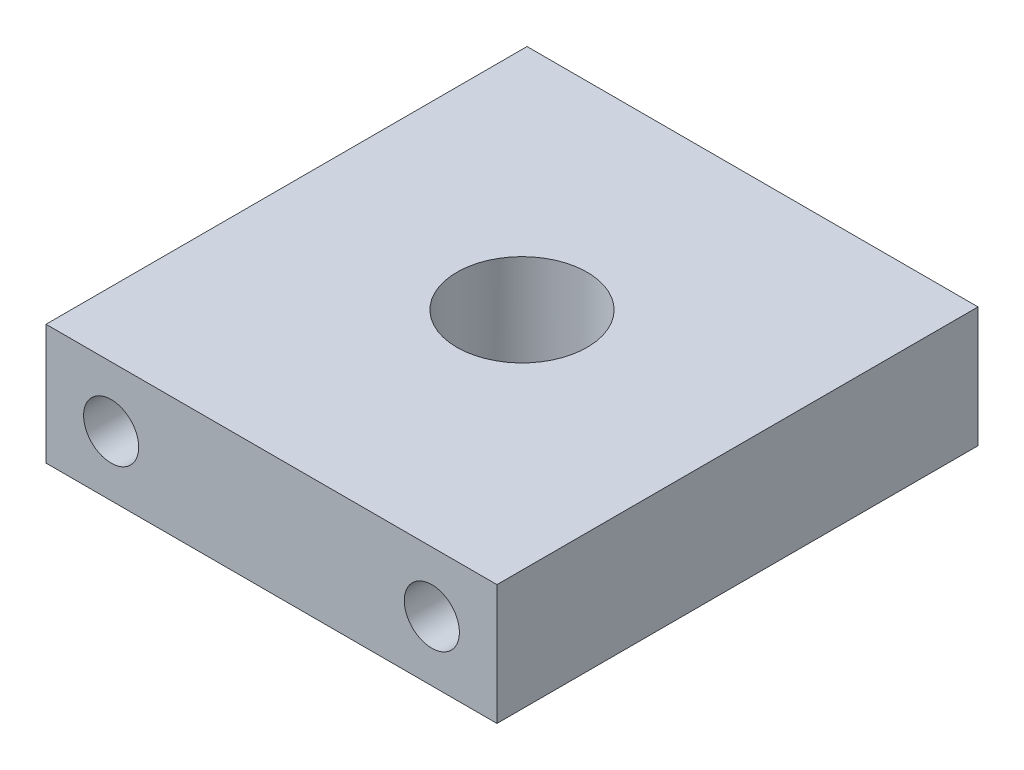
from build123d import *

# Parameters (mm, degrees)
SKETCH_1_W                = 45
SKETCH_1_H                = 48
EXTRUDE_1_DEPTH           = 12
SKETCH_2_R                = 6.5
CUT_EXTRUDE_1_DEPTH       = 12
HOLE_WIZARD_1_D           = 5.5
HOLE_WIZARD_1_CBORE_D     = 9.5
HOLE_WIZARD_1_CBORE_DEPTH = 30
SKETCH_14_R               = 3
CUT_EXTRUDE_2_DEPTH       = 8


with BuildPart() as part:
    # 草图1 → 凸台-拉伸1 (new body)
    with BuildSketch(Plane(origin=(0, 0, 0), x_dir=(1, 0, 0), z_dir=(0, 1, 0))):
        with Locations((22.5, 24)):
            Rectangle(SKETCH_1_W, SKETCH_1_H)
    extrude(amount=EXTRUDE_1_DEPTH)

    # 草图2 → 切除-拉伸1 (cut)
    with BuildSketch(Plane(origin=(0, 12, 0), x_dir=(1, 0, 0), z_dir=(0, 1, 0))):
        with Locations(Location((22.5, 25, 0), (0, 0, 270))):
            Circle(SKETCH_2_R)
    extrude(amount=-CUT_EXTRUDE_1_DEPTH, mode=Mode.SUBTRACT)

    # 打孔尺寸根据内六角圆柱头螺钉的类型1 (through all)
    with Locations(Plane(origin=(0, 0, -48), x_dir=(-1, 0, 0), z_dir=(0, 0, -1))):
        with Locations((-38.5, 6), (-6.5, 6)):
            CounterBoreHole(HOLE_WIZARD_1_D / 2, HOLE_WIZARD_1_CBORE_D / 2, HOLE_WIZARD_1_CBORE_DEPTH)

    # 草图14 → 切除-拉伸2 (cut)
    with BuildSketch(Plane.XZ):
        with Locations(Location((14.5, -43, 0), (0, 0, 270))):
            Circle(SKETCH_14_R)
        with Locations(Location((30.5, -43, 0), (0, 0, 270))):
            Circle(SKETCH_14_R)
    extrude(amount=-CUT_EXTRUDE_2_DEPTH, mode=Mode.SUBTRACT)


solid = part.part
